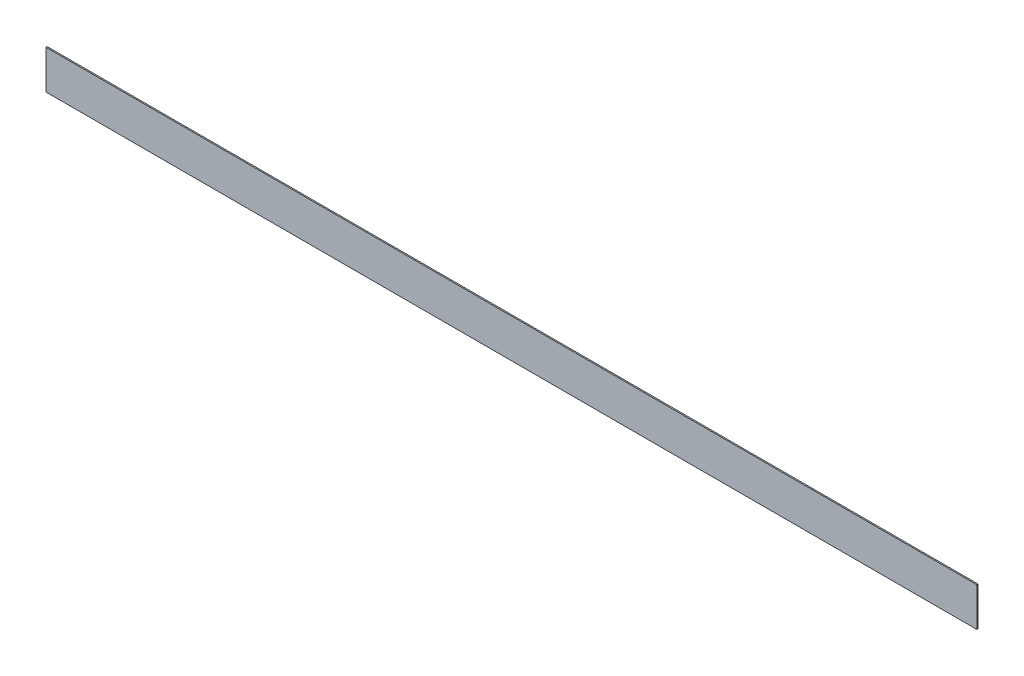
from build123d import *

# Parameters (mm, degrees)
SKETCH1_W           = 1219.2
SKETCH1_H           = 50.8
BOSS_EXTRUDE1_DEPTH = 1.5875


with BuildPart() as part:
    # Sketch1 → Boss-Extrude1 (new body)
    with BuildSketch(Plane.XY):
        with Locations((-609.6, -25.4)):
            Rectangle(SKETCH1_W, SKETCH1_H)
    extrude(amount=BOSS_EXTRUDE1_DEPTH)


solid = part.part
